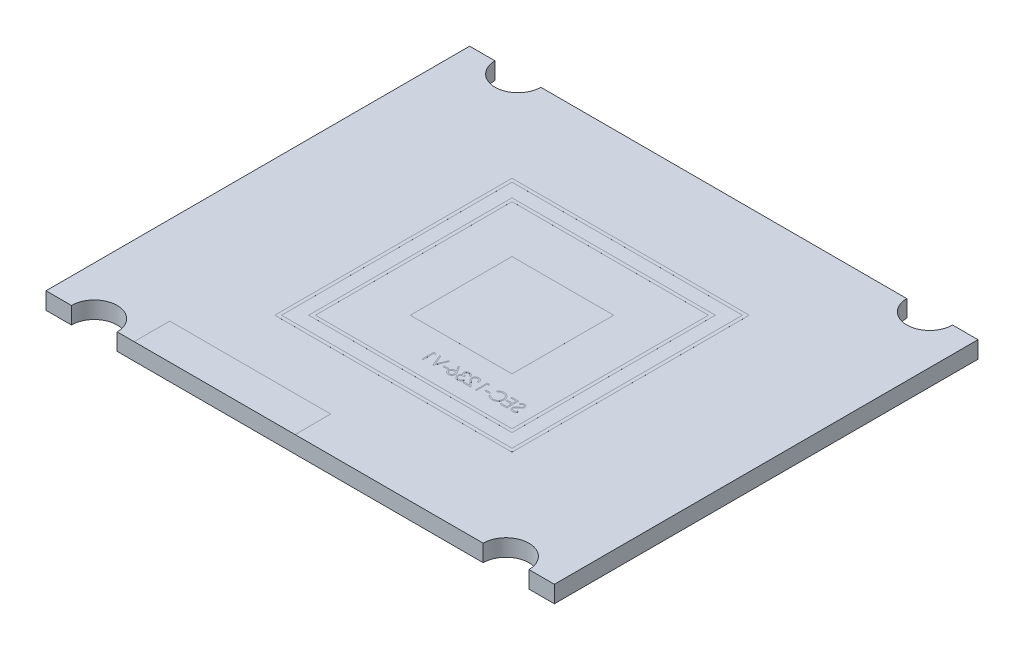
from build123d import *

# Parameters (mm, degrees)
SKETCH1_W               = 30
SKETCH1_H               = 25
BOSS_EXTRUDE1_DEPTH     = 0.5
CUT_EXTRUDE2_DEPTH      = 20.532024985
CUT_EXTRUDE2_DEPTH_BACK = 20.532024985
SKETCH3_R               = 1.35
SKETCH2_W               = 6
SKETCH2_H               = 6
BOSS_EXTRUDE2_DEPTH     = 0.50005
SKETCH4_R               = 2.25
BOSS_EXTRUDE3_DEPTH     = 2
SKETCH5_R               = 0.5
CUT_EXTRUDE3_DEPTH      = 0.4
REVOLVE1_ANGLE          = 180
CHAMFER1_SIZE           = 0.2
SKETCH9_W               = 9.5
SKETCH9_H               = 2.1
MARCA_O_FIOS_DEPTH      = 0.50005
SKETCH10_W              = 14
SKETCH10_H              = 14
SKETCH10_W_2            = 13.6
SKETCH10_H_2            = 13.6
SKETCH10_W_3            = 12
SKETCH10_H_3            = 12
SKETCH10_W_4            = 11.6
SKETCH10_H_4            = 11.6
CONTORNO_C_MERA_DEPTH   = 0.5005
SKETCH11_W              = 0.26923077
SKETCH11_H              = 0.071794871
BOSS_EXTRUDE6_DEPTH     = 0.5005


with BuildPart() as part:
    # Sketch1 → Boss-Extrude1 (new, symmetric)
    with BuildSketch(Plane(origin=(0, 0, 0), x_dir=(1, 0, 0), z_dir=(0, 1, 0))):
        Rectangle(SKETCH1_W, SKETCH1_H)
    extrude(amount=BOSS_EXTRUDE1_DEPTH, both=True)

    # Sketch3 → Cut-Extrude2 (cut, two sides: drawn at the far end of the back side and taken through both)
    with BuildSketch(Plane(origin=(0, 0, 0), x_dir=(1, 0, 0), z_dir=(0, 1, 0)).offset(-CUT_EXTRUDE2_DEPTH_BACK)):
        with Locations((-12.15, 12.5)):
            Circle(SKETCH3_R)
        with Locations((12.15, 12.5)):
            Circle(SKETCH3_R)
        with Locations((12.15, -12.5)):
            Circle(SKETCH3_R)
        with Locations((-12.15, -12.5)):
            Circle(SKETCH3_R)
    extrude(amount=CUT_EXTRUDE2_DEPTH + CUT_EXTRUDE2_DEPTH_BACK, mode=Mode.SUBTRACT)

    # Sketch2 → Boss-Extrude2 (add, symmetric)
    with BuildSketch(Plane(origin=(0, 0, 0), x_dir=(1, 0, 0), z_dir=(0, 1, 0))):
        Rectangle(SKETCH2_W, SKETCH2_H)
    extrude(amount=BOSS_EXTRUDE2_DEPTH, both=True)

    # Sketch4 → Boss-Extrude3 (add)
    with BuildSketch(Plane.XZ.offset(0.50005)):
        with Locations(Location((0, 0, 0), (0, 0, 270))):
            Circle(SKETCH4_R)
    extrude(amount=BOSS_EXTRUDE3_DEPTH)

    # Sketch5 → Cut-Extrude3 (cut)
    with BuildSketch(Plane.XZ.offset(2.50005)):
        with Locations(Location((0, 0, 0), (0, 0, 270))):
            Circle(SKETCH5_R)
    extrude(amount=-CUT_EXTRUDE3_DEPTH, mode=Mode.SUBTRACT)

    # Sketch6 → Revolve1 (revolve)
    with BuildSketch(Plane.XZ.offset(2.10005)):
        with BuildLine():
            Line((-0.5, 0), (0.5, 0))
            ThreePointArc((0.5, 0), (0, 0.5), (-0.5, 0))
        make_face()
    revolve(axis=Axis((-0.5, -2.10005, 0), (1, 0, 0)), revolution_arc=REVOLVE1_ANGLE)

    # Chamfer1
    chamfer1_edges = [part.edges().sort_by_distance(p)[0] for p in [
        (0, -0.50005, 2.25),
        (0, -2.50005, 2.25),
        (0, -2.50005, 0.5),
    ]]
    chamfer(chamfer1_edges, length=CHAMFER1_SIZE)

    # Sketch9 → Marcação Fios (add, symmetric)
    with BuildSketch(Plane(origin=(0, 0, 0), x_dir=(1, 0, 0), z_dir=(0, 1, 0))):
        with Locations((-5.05, -11.45)):
            Rectangle(SKETCH9_W, SKETCH9_H)
    extrude(amount=MARCA_O_FIOS_DEPTH, both=True)

    # Sketch10 → Contorno Câmera (add, symmetric)
    # profile 1 of 2: a face of its own
    with BuildSketch(Plane(origin=(0, 0, 0), x_dir=(1, 0, 0), z_dir=(0, 1, 0))):
        Rectangle(SKETCH10_W, SKETCH10_H)
        Rectangle(SKETCH10_W_2, SKETCH10_H_2, mode=Mode.SUBTRACT)
    # profile 2 of 2: a face of its own
    with BuildSketch(Plane(origin=(0, 0, 0), x_dir=(1, 0, 0), z_dir=(0, 1, 0))):
        Rectangle(SKETCH10_W_3, SKETCH10_H_3)
        Rectangle(SKETCH10_W_4, SKETCH10_H_4, mode=Mode.SUBTRACT)
    extrude(amount=CONTORNO_C_MERA_DEPTH, both=True)

    # Sketch11 → Boss-Extrude6 (add, symmetric)
    # profile 1 of 11: a face of its own
    with BuildSketch(Plane(origin=(0, 0, 0), x_dir=(1, 0, 0), z_dir=(0, 1, 0))):
        with BuildLine():
            Line((5.140170855, -4.761384611), (5.080996176, -4.725907848))
            add(Edge.make_bspline(
                [(5.080996176, -4.725907848), (5.075492528, -4.735120725), (5.064947752, -4.752772242), (5.04735748, -4.77662385), (5.029130898, -4.796896281), (5.010133032, -4.813471603), (4.990479842, -4.82652138), (4.970043031, -4.835761827), (4.948891469, -4.841525022), (4.934496705, -4.842225039), (4.927310278, -4.842574515)],
                knots=[0, 0, 0, 0, 1.272034388, 2.437168799, 3.508375237, 4.49857839, 5.41946034, 6.295179144, 7.148887113, 8, 8, 8, 8], degree=3))
            add(Edge.make_bspline(
                [(4.927310278, -4.842574515), (4.921172906, -4.84240358), (4.909005552, -4.842064702), (4.891093103, -4.838808542), (4.873696743, -4.833806116), (4.857175015, -4.82664193), (4.841755892, -4.817974233), (4.828234553, -4.807504997), (4.816545331, -4.795783756), (4.806983508, -4.782707225), (4.799647501, -4.768643795), (4.794009087, -4.754208605), (4.790880072, -4.739174891), (4.790408721, -4.729052799), (4.790170855, -4.723944707)],
                knots=[0, 0, 0, 0, 1.095163259, 2.171163733, 3.241058638, 4.321873601, 5.38011039, 6.391990106, 7.366004449, 8.327778327, 9.272591725, 10.192022065, 11.087607919, 12, 12, 12, 12], degree=3))
            add(Edge.make_bspline(
                [(4.790170855, -4.723944707), (4.790465718, -4.718116537), (4.791065129, -4.706268719), (4.796131425, -4.688788789), (4.804101275, -4.671490275), (4.811453803, -4.660790022), (4.815271016, -4.655234771)],
                knots=[0, 0, 0, 0, 0.938893495, 1.908633276, 2.914225137, 4, 4, 4, 4], degree=3))
            add(Edge.make_bspline(
                [(4.815271016, -4.655234771), (4.818405138, -4.651225407), (4.824984837, -4.642808247), (4.83629634, -4.6302792), (4.849569563, -4.617355516), (4.864350274, -4.603543705), (4.881176891, -4.589486145), (4.899522394, -4.57451249), (4.919855166, -4.559192174), (4.934115065, -4.548917661), (4.941472939, -4.543616182)],
                knots=[0, 0, 0, 0, 0.722233717, 1.516239348, 2.393582979, 3.351407094, 4.387010283, 5.505090956, 6.712668013, 8, 8, 8, 8], degree=3))
            add(Edge.make_bspline(
                [(4.941472939, -4.543616182), (4.948837738, -4.538370464), (4.962918673, -4.528341052), (4.98261039, -4.513456195), (5.000219282, -4.499847421), (5.015667086, -4.487386618), (5.028947005, -4.476072097), (5.040163687, -4.46601251), (5.049031399, -4.456935797), (5.053962515, -4.451047529), (5.056176464, -4.448403842)],
                knots=[0, 0, 0, 0, 1.452282411, 2.77665338, 3.964542531, 5.026858415, 5.96415736, 6.766646006, 7.446254459, 8, 8, 8, 8], degree=3))
            add(Edge.make_bspline(
                [(5.056176464, -4.448403842), (5.059270973, -4.444283634), (5.065356741, -4.436180694), (5.073389942, -4.423515722), (5.080217774, -4.410551069), (5.085570241, -4.397251896), (5.090077485, -4.38380491), (5.093109071, -4.370034661), (5.09500735, -4.356002938), (5.095201747, -4.346560237), (5.095299061, -4.341833329)],
                knots=[0, 0, 0, 0, 1.068054152, 2.10047183, 3.106115577, 4.101338837, 5.06977816, 6.043150881, 7.020423561, 8, 8, 8, 8], degree=3))
            add(Edge.make_bspline(
                [(5.095299061, -4.341833329), (5.095038019, -4.334427374), (5.094521515, -4.319773761), (5.090153411, -4.298367595), (5.083258833, -4.277930312), (5.073599855, -4.258664245), (5.061148384, -4.241071049), (5.046739189, -4.224948351), (5.029576892, -4.211394635), (5.010746368, -4.199552223), (4.990135093, -4.190283038), (4.968536912, -4.183290842), (4.945917498, -4.179328991), (4.930596871, -4.178760438), (4.922823099, -4.178471951)],
                knots=[0, 0, 0, 0, 1.005424448, 1.989358655, 2.955360095, 3.929531133, 4.905563448, 5.876582895, 6.856512386, 7.866279853, 8.892233794, 9.918561126, 10.94386622, 12, 12, 12, 12], degree=3))
            add(Edge.make_bspline(
                [(4.922823099, -4.178471951), (4.914574279, -4.178756461), (4.898170009, -4.179322261), (4.874040165, -4.184241768), (4.850808022, -4.192381902), (4.832119369, -4.201619634), (4.817492817, -4.210845917), (4.80633827, -4.219249882), (4.79503478, -4.228924903), (4.783491169, -4.239896752), (4.771903037, -4.252266103), (4.760098347, -4.26594824), (4.748049493, -4.280859552), (4.740298321, -4.291504452), (4.736324702, -4.296961534)],
                knots=[0, 0, 0, 0, 1.286793592, 2.559021753, 3.825965368, 5.121522368, 5.803751409, 6.523245864, 7.299691795, 8.125521123, 9.008227632, 9.944561021, 10.946284179, 12, 12, 12, 12], degree=3))
            Line((4.736324702, -4.296961534), (4.793115567, -4.340010412))
            add(Edge.make_bspline(
                [(4.793115567, -4.340010412), (4.796544753, -4.335592674), (4.803148565, -4.327085144), (4.813174462, -4.31517088), (4.822624192, -4.304287585), (4.831934272, -4.294834559), (4.840612998, -4.286294132), (4.849036406, -4.278982181), (4.857083277, -4.272827062), (4.867226659, -4.26625835), (4.879970203, -4.259747049), (4.89596711, -4.254237233), (4.912684365, -4.250926221), (4.924070291, -4.250488444), (4.929834317, -4.250266823)],
                knots=[0, 0, 0, 0, 1.181633172, 2.275549214, 3.290209073, 4.226197932, 5.078386478, 5.862611352, 6.581680152, 7.217281963, 8.414376989, 9.595101626, 10.782541182, 12, 12, 12, 12], degree=3))
            add(Edge.make_bspline(
                [(4.929834317, -4.250266823), (4.937065621, -4.250509163), (4.951010511, -4.250976492), (4.970808558, -4.256080489), (4.988627343, -4.264116862), (5.003937856, -4.275379857), (5.016685252, -4.288724056), (5.025906343, -4.304079827), (5.031456376, -4.321036307), (5.032133632, -4.332864638), (5.032478548, -4.338888617)],
                knots=[0, 0, 0, 0, 1.14458467, 2.207223713, 3.21896685, 4.227309161, 5.202851033, 6.127160689, 7.046193047, 8, 8, 8, 8], degree=3))
            add(Edge.make_bspline(
                [(5.032478548, -4.338888617), (5.032399922, -4.342638913), (5.032242543, -4.350145637), (5.030047584, -4.361235921), (5.027227718, -4.372298189), (5.022759191, -4.383282706), (5.016590131, -4.394381578), (5.008489096, -4.405785925), (4.998286433, -4.417596267), (4.990471031, -4.425277742), (4.986344734, -4.429333329)],
                knots=[0, 0, 0, 0, 0.858281714, 1.717966888, 2.583508476, 3.4729293, 4.427298488, 5.488583878, 6.674047936, 8, 8, 8, 8], degree=3))
            add(Edge.make_bspline(
                [(4.986344734, -4.429333329), (4.984812459, -4.430700734), (4.981172126, -4.433949376), (4.974516941, -4.439267832), (4.965728381, -4.445828386), (4.955035941, -4.45394585), (4.942242468, -4.463362142), (4.927346557, -4.473956865), (4.910514251, -4.486073956), (4.898569867, -4.494545464), (4.892254189, -4.499024835)],
                knots=[0, 0, 0, 0, 0.420754252, 0.999615792, 1.744751191, 2.668019286, 3.750313428, 4.999500688, 6.413464383, 8, 8, 8, 8], degree=3))
            add(Edge.make_bspline(
                [(4.892254189, -4.499024835), (4.884657006, -4.504553107), (4.869946115, -4.51525784), (4.849014599, -4.531340976), (4.830035837, -4.547070529), (4.812943196, -4.562346051), (4.797567815, -4.577051669), (4.784080271, -4.591364305), (4.772343135, -4.60518142), (4.759707291, -4.622895935), (4.746795727, -4.644652152), (4.735707425, -4.6713078), (4.728715756, -4.698067064), (4.727801453, -4.716052431), (4.727350343, -4.724926278)],
                knots=[0, 0, 0, 0, 1.163667725, 2.253281268, 3.268753668, 4.215851969, 5.092017293, 5.902905408, 6.650798638, 7.335211899, 8.59617414, 9.77448103, 10.901945474, 12, 12, 12, 12], degree=3))
            add(Edge.make_bspline(
                [(4.727350343, -4.724926278), (4.72748177, -4.731201951), (4.727742073, -4.743631427), (4.730734256, -4.761882443), (4.735118189, -4.779608617), (4.741725636, -4.796590839), (4.749790267, -4.813139792), (4.760023517, -4.828821372), (4.771885054, -4.843982652), (4.785491807, -4.85821935), (4.800380987, -4.871288589), (4.816117726, -4.882914401), (4.832727781, -4.892608066), (4.850121044, -4.900518234), (4.868301512, -4.906704938), (4.887263068, -4.911187512), (4.907036971, -4.913938654), (4.920477067, -4.914224206), (4.927310278, -4.914369387)],
                knots=[0, 0, 0, 0, 0.983748083, 1.948392443, 2.894712957, 3.844097841, 4.80183111, 5.778335162, 6.776009319, 7.81870978, 8.863265674, 9.881300176, 10.883814829, 11.87499822, 12.874611388, 13.892143829, 14.928324115, 16, 16, 16, 16], degree=3))
            add(Edge.make_bspline(
                [(4.927310278, -4.914369387), (4.932597347, -4.91426715), (4.943104899, -4.914063965), (4.958646795, -4.912267709), (4.973874713, -4.909726288), (4.98859757, -4.905691474), (5.003005052, -4.900796079), (5.017034499, -4.894768413), (5.03069271, -4.887544972), (5.044056226, -4.879285967), (5.057091061, -4.869674418), (5.069674955, -4.858479719), (5.082220792, -4.846010618), (5.094358271, -4.831928505), (5.1063329, -4.816460889), (5.117908582, -4.799463052), (5.129324925, -4.781027581), (5.136488019, -4.768054564), (5.140170855, -4.761384611)],
                knots=[0, 0, 0, 0, 0.915332311, 1.819136955, 2.706846663, 3.586547465, 4.459518054, 5.340707479, 6.227863349, 7.133153174, 8.059268498, 9.028702269, 10.047606654, 11.120612155, 12.245963614, 13.433783089, 14.680604001, 16, 16, 16, 16], degree=3))
        make_face()
    # profile 2 of 11: a face of its own
    with BuildSketch(Plane(origin=(0, 0, 0), x_dir=(1, 0, 0), z_dir=(0, 1, 0))):
        Polygon((4.583760599, -4.196420669), (4.188888804, -4.196420669), (4.188888804, -4.268215541), (4.520940086, -4.268215541), (4.520940086, -4.483600156), (4.188888804, -4.483600156), (4.188888804, -4.555395028), (4.520940086, -4.555395028), (4.520940086, -4.824625797), (4.188888804, -4.824625797), (4.188888804, -4.896420669), (4.583760599, -4.896420669), align=None)
    # profile 3 of 11: a face of its own
    with BuildSketch(Plane(origin=(0, 0, 0), x_dir=(1, 0, 0), z_dir=(0, 1, 0))):
        with BuildLine():
            Line((3.417093932, -4.324866182), (3.472061881, -4.366933489))
            add(Edge.make_bspline(
                [(3.472061881, -4.366933489), (3.475983059, -4.362260295), (3.483772548, -4.352976912), (3.496304389, -4.339941003), (3.509364717, -4.327727951), (3.522948541, -4.316279575), (3.537300365, -4.305996222), (3.552072525, -4.296342001), (3.567512134, -4.287688454), (3.588862481, -4.277195856), (3.616792051, -4.266246625), (3.651951018, -4.257065979), (3.688653238, -4.251221744), (3.713692758, -4.250588776), (3.726428868, -4.250266823)],
                knots=[0, 0, 0, 0, 0.757959112, 1.505699292, 2.245454638, 2.979532153, 3.711538275, 4.438200793, 5.171680507, 5.909471876, 7.393775596, 8.890124382, 10.418191784, 12, 12, 12, 12], degree=3))
            add(Edge.make_bspline(
                [(3.726428868, -4.250266823), (3.733445528, -4.250347615), (3.747413727, -4.25050845), (3.768143421, -4.252630275), (3.788486032, -4.255612517), (3.808428325, -4.260037582), (3.827944916, -4.265632106), (3.847163397, -4.272317189), (3.865805517, -4.280588156), (3.884129164, -4.289729808), (3.901685007, -4.300055297), (3.918296016, -4.311317968), (3.93390161, -4.323391787), (3.948514132, -4.336322008), (3.962148522, -4.3500504), (3.974705984, -4.364723269), (3.986143066, -4.380293703), (3.996686471, -4.396556385), (4.006129018, -4.413463943), (4.014034994, -4.431078957), (4.021036018, -4.449099778), (4.026575867, -4.46773001), (4.03096077, -4.486838563), (4.033986303, -4.506476721), (4.036083997, -4.526603457), (4.036244032, -4.540245319), (4.036324702, -4.547121791)],
                knots=[0, 0, 0, 0, 1.054917814, 2.100044995, 3.131103042, 4.146048494, 5.169673617, 6.183595914, 7.203665975, 8.234915748, 9.262203917, 10.264457458, 11.251630812, 12.227803204, 13.197192746, 14.159520551, 15.12972552, 16.100847026, 17.073214652, 18.039054194, 19.002613845, 19.979014051, 20.95965708, 21.949030935, 22.966165397, 24, 24, 24, 24], degree=3))
            add(Edge.make_bspline(
                [(4.036324702, -4.547121791), (4.036072338, -4.557468054), (4.035576855, -4.577781571), (4.031167188, -4.607535694), (4.02446617, -4.636039828), (4.014423054, -4.663115797), (4.002039244, -4.689097468), (3.986391122, -4.713545239), (3.968267815, -4.736828552), (3.947412931, -4.758397142), (3.924531767, -4.778099887), (3.899982185, -4.795450003), (3.873825328, -4.809912979), (3.846350002, -4.821948169), (3.817344779, -4.831199514), (3.786861818, -4.837712339), (3.754967419, -4.841960775), (3.733173539, -4.842367513), (3.722081913, -4.842574515)],
                knots=[0, 0, 0, 0, 1.029171465, 2.020641659, 2.987623507, 3.938342917, 4.889210282, 5.84687017, 6.821220943, 7.821438502, 8.827599549, 9.822697543, 10.807740252, 11.797342354, 12.80366471, 13.83203677, 14.896651826, 16, 16, 16, 16], degree=3))
            add(Edge.make_bspline(
                [(3.722081913, -4.842574515), (3.709861375, -4.842236759), (3.685808433, -4.841571974), (3.650534828, -4.835940125), (3.616767675, -4.826808541), (3.584505158, -4.814028957), (3.553838229, -4.797415899), (3.524718896, -4.777276323), (3.497122582, -4.753418657), (3.480528326, -4.735202031), (3.472061881, -4.725907848)],
                knots=[0, 0, 0, 0, 1.028121516, 2.023589091, 2.998037872, 3.967518031, 4.937445131, 5.927275754, 6.942489185, 8, 8, 8, 8], degree=3))
            Line((3.472061881, -4.725907848), (3.417093932, -4.767554483))
            add(Edge.make_bspline(
                [(3.417093932, -4.767554483), (3.421517554, -4.773262173), (3.430343609, -4.784650214), (3.444635213, -4.800704556), (3.459690672, -4.815805363), (3.475621814, -4.829830888), (3.492245373, -4.843061781), (3.509859835, -4.855122147), (3.528233641, -4.866180324), (3.547304537, -4.876305709), (3.56705226, -4.885289158), (3.587453147, -4.892979912), (3.608419262, -4.89960489), (3.629951564, -4.905055277), (3.652094715, -4.909309494), (3.67476881, -4.912153429), (3.698022785, -4.914101812), (3.713711069, -4.914279395), (3.72166124, -4.914369387)],
                knots=[0, 0, 0, 0, 0.986787822, 1.968848986, 2.935600012, 3.899624008, 4.868462664, 5.837806735, 6.815139263, 7.798259679, 8.787526145, 9.778297419, 10.776456485, 11.791383307, 12.812564526, 13.85620153, 14.913611965, 16, 16, 16, 16], degree=3))
            add(Edge.make_bspline(
                [(3.72166124, -4.914369387), (3.729189973, -4.914316988), (3.744077111, -4.914213377), (3.766056862, -4.912534943), (3.787454778, -4.910244996), (3.808209703, -4.906796969), (3.828434898, -4.902728101), (3.847947015, -4.89727385), (3.866938057, -4.891164017), (3.885331725, -4.883983019), (3.903143665, -4.875879783), (3.920316427, -4.866721471), (3.936842114, -4.856585098), (3.952883198, -4.845694096), (3.968202715, -4.833698636), (3.98293342, -4.820765309), (3.997157915, -4.806937707), (4.005958452, -4.796966736), (4.010383195, -4.791953521)],
                knots=[0, 0, 0, 0, 1.114604814, 2.203992996, 3.262667896, 4.300477797, 5.318619304, 6.316056647, 7.298880507, 8.271930387, 9.238335007, 10.195173496, 11.151986948, 12.108099108, 13.064862484, 14.031167946, 15.010108607, 16, 16, 16, 16], degree=3))
            add(Edge.make_bspline(
                [(4.010383195, -4.791953521), (4.017470324, -4.783245283), (4.031559019, -4.765933941), (4.049584156, -4.737876745), (4.065013667, -4.708583103), (4.077488851, -4.677899118), (4.087241398, -4.64589364), (4.093997637, -4.612550537), (4.098387958, -4.577900949), (4.098890015, -4.554333591), (4.099145214, -4.542354162)],
                knots=[0, 0, 0, 0, 0.994628077, 1.977248131, 2.950237994, 3.925870899, 4.908910175, 5.911660606, 6.938484602, 8, 8, 8, 8], degree=3))
            add(Edge.make_bspline(
                [(4.099145214, -4.542354162), (4.098834176, -4.529763072), (4.098222226, -4.504990887), (4.093023067, -4.468636096), (4.084659308, -4.433805816), (4.07277993, -4.400565067), (4.05771886, -4.368739011), (4.039113537, -4.33857077), (4.017180109, -4.30986741), (3.992090595, -4.28306446), (3.964577128, -4.25855659), (3.935113365, -4.236995349), (3.903756976, -4.219051846), (3.870853406, -4.204052613), (3.836156269, -4.192523721), (3.799739596, -4.184453083), (3.761671813, -4.17942966), (3.735699328, -4.178794618), (3.722502586, -4.178471951)],
                knots=[0, 0, 0, 0, 1.032925535, 2.032216505, 3.007276963, 3.968222605, 4.92396291, 5.891752235, 6.871517503, 7.883894988, 8.900124299, 9.891468569, 10.874487609, 11.85992873, 12.854644235, 13.869047385, 14.917252991, 16, 16, 16, 16], degree=3))
            add(Edge.make_bspline(
                [(3.722502586, -4.178471951), (3.714459692, -4.178568378), (3.698539592, -4.178759247), (3.674989062, -4.180620476), (3.652060596, -4.183723197), (3.6297384, -4.187946411), (3.607913877, -4.193187875), (3.586753829, -4.200015935), (3.566134091, -4.207823241), (3.54618471, -4.216814934), (3.5270014, -4.226908283), (3.508590136, -4.237991407), (3.491097164, -4.250050568), (3.474399394, -4.262983203), (3.458776152, -4.277062915), (3.443783857, -4.291902434), (3.429931641, -4.307929199), (3.421381002, -4.319210186), (3.417093932, -4.324866182)],
                knots=[0, 0, 0, 0, 1.096760587, 2.17092713, 3.219439832, 4.250915756, 5.268269357, 6.278326846, 7.281116186, 8.274029601, 9.260640565, 10.235837813, 11.203064059, 12.156899882, 13.114053108, 14.069676657, 15.032185724, 16, 16, 16, 16], degree=3))
        make_face()
    # profile 4 of 11: a face of its own
    with BuildSketch(Plane(origin=(0, 0, 0), x_dir=(1, 0, 0), z_dir=(0, 1, 0))):
        with Locations((3.201709317, -4.6271899)):
            Rectangle(SKETCH11_W, SKETCH11_H)
    # profile 5 of 11: a face of its own
    with BuildSketch(Plane(origin=(0, 0, 0), x_dir=(1, 0, 0), z_dir=(0, 1, 0))):
        Polygon((2.864469734, -4.196420669), (2.73504265, -4.196420669), (2.73504265, -4.896420669), (2.797863163, -4.896420669), (2.797863163, -4.268215541), (2.905555471, -4.268215541), align=None)
    # profile 6 of 11: a face of its own
    with BuildSketch(Plane(origin=(0, 0, 0), x_dir=(1, 0, 0), z_dir=(0, 1, 0))):
        with BuildLine():
            Line((2.38504265, -4.411805284), (2.447863163, -4.411805284))
            add(Edge.make_bspline(
                [(2.447863163, -4.411805284), (2.447453732, -4.403471107), (2.446649622, -4.387103004), (2.442883964, -4.363238222), (2.437495788, -4.340427263), (2.429877498, -4.31885328), (2.420416242, -4.298325518), (2.409070237, -4.278925515), (2.395631466, -4.260727277), (2.38039012, -4.243899509), (2.363836392, -4.228461995), (2.345975204, -4.215130946), (2.327206198, -4.203867412), (2.307586319, -4.194451163), (2.286894206, -4.187383194), (2.265317634, -4.182138866), (2.242761807, -4.178983597), (2.227393803, -4.17864444), (2.219577907, -4.178471951)],
                knots=[0, 0, 0, 0, 1.10065271, 2.161652631, 3.183658789, 4.190468796, 5.17591951, 6.163126047, 7.15150782, 8.156236427, 9.156009102, 10.134482811, 11.092018607, 12.041330605, 13.001268258, 13.972401359, 14.968799086, 16, 16, 16, 16], degree=3))
            add(Edge.make_bspline(
                [(2.219577907, -4.178471951), (2.211902292, -4.178651642), (2.196819983, -4.179004729), (2.17480758, -4.182036935), (2.153852121, -4.186786053), (2.133994568, -4.193449136), (2.115393355, -4.202406022), (2.097908746, -4.21316553), (2.081332584, -4.225609496), (2.066411227, -4.240260259), (2.052709611, -4.255900736), (2.04088916, -4.272598316), (2.030766528, -4.289844173), (2.022328992, -4.307769814), (2.016117764, -4.326544019), (2.011402122, -4.34589346), (2.008736639, -4.366018422), (2.008327555, -4.379639733), (2.008119573, -4.386564899)],
                knots=[0, 0, 0, 0, 1.111607364, 2.184268762, 3.212621178, 4.221274766, 5.211760367, 6.196651075, 7.1921475, 8.207485113, 9.220403448, 10.201281604, 11.166441695, 12.114753415, 13.065576456, 14.026450734, 14.996634279, 16, 16, 16, 16], degree=3))
            add(Edge.make_bspline(
                [(2.008119573, -4.386564899), (2.008458226, -4.396314466), (2.009129588, -4.415642509), (2.014872463, -4.444045482), (2.023841766, -4.471564165), (2.034641237, -4.493711626), (2.045535726, -4.511558325), (2.055353227, -4.526252066), (2.06684619, -4.542073159), (2.080181889, -4.558968627), (2.095084464, -4.577070808), (2.111688896, -4.596368767), (2.130113593, -4.616663121), (2.143045293, -4.630524241), (2.149746176, -4.637706726)],
                knots=[0, 0, 0, 0, 1.184426356, 2.348067706, 3.509069118, 4.696110526, 5.333549288, 6.050745305, 6.844228056, 7.710549037, 8.667450064, 9.695053472, 10.805634456, 12, 12, 12, 12], degree=3))
            Line((2.149746176, -4.637706726), (2.3248864, -4.824625797))
            Line((2.3248864, -4.824625797), (1.999145214, -4.824625797))
            Line((1.999145214, -4.824625797), (1.999145214, -4.896420669))
            Line((1.999145214, -4.896420669), (2.47478624, -4.896420669))
            Line((2.47478624, -4.896420669), (2.203311881, -4.606717143))
            add(Edge.make_bspline(
                [(2.203311881, -4.606717143), (2.196702304, -4.599817482), (2.184006658, -4.586564644), (2.166050143, -4.567216052), (2.149922345, -4.549266144), (2.135518867, -4.532748835), (2.123152166, -4.517422521), (2.112177719, -4.50378358), (2.103384601, -4.49123269), (2.093841522, -4.476684567), (2.084598726, -4.458922104), (2.076656254, -4.437215366), (2.071813285, -4.414869916), (2.071232318, -4.399769508), (2.070940086, -4.392173874)],
                knots=[0, 0, 0, 0, 1.329631726, 2.553950428, 3.673215718, 4.687767853, 5.603093632, 6.413772471, 7.123043292, 7.734684054, 8.834405432, 9.900288307, 10.943827018, 12, 12, 12, 12], degree=3))
            add(Edge.make_bspline(
                [(2.070940086, -4.392173874), (2.071067235, -4.387397594), (2.07131782, -4.377984464), (2.073529359, -4.364183312), (2.076871461, -4.35087035), (2.081660512, -4.338004626), (2.08798186, -4.325715495), (2.095676536, -4.313987999), (2.104554549, -4.302650206), (2.114824803, -4.292019547), (2.126107107, -4.282283305), (2.138025957, -4.273658488), (2.150635977, -4.266450666), (2.163884002, -4.260541967), (2.177733096, -4.255906891), (2.192210045, -4.252695175), (2.207274848, -4.250678678), (2.217561547, -4.250405844), (2.222803067, -4.250266823)],
                knots=[0, 0, 0, 0, 0.991446411, 1.95395049, 2.89581595, 3.838931463, 4.798493298, 5.75982156, 6.748411868, 7.785213223, 8.824556874, 9.840280684, 10.836137867, 11.835679398, 12.848801643, 13.863922112, 14.911575587, 16, 16, 16, 16], degree=3))
            add(Edge.make_bspline(
                [(2.222803067, -4.250266823), (2.228277233, -4.250409829), (2.239027593, -4.25069067), (2.254811399, -4.252655203), (2.269868555, -4.256044371), (2.284236935, -4.260679706), (2.297940853, -4.266571416), (2.310913661, -4.273909765), (2.323126239, -4.282666463), (2.334601544, -4.292594574), (2.34517434, -4.303648095), (2.354463715, -4.315970087), (2.362580518, -4.32933557), (2.369662364, -4.34370848), (2.375413502, -4.359219236), (2.379808132, -4.375812777), (2.383285502, -4.393417054), (2.384447206, -4.405574071), (2.38504265, -4.411805284)],
                knots=[0, 0, 0, 0, 1.031018746, 2.02475058, 2.990194455, 3.934040569, 4.864654155, 5.795059489, 6.735614925, 7.690564532, 8.649604399, 9.611025574, 10.590972636, 11.591080095, 12.624614302, 13.701020113, 14.821632451, 16, 16, 16, 16], degree=3))
        make_face()
    # profile 7 of 11: a face of its own
    with BuildSketch(Plane(origin=(0, 0, 0), x_dir=(1, 0, 0), z_dir=(0, 1, 0))):
        with BuildLine():
            Line((1.846581112, -4.35795913), (1.909401625, -4.35795913))
            add(Edge.make_bspline(
                [(1.909401625, -4.35795913), (1.907699714, -4.350912633), (1.904372619, -4.337137309), (1.897433105, -4.317455856), (1.889873254, -4.298831152), (1.880795433, -4.281611937), (1.870893682, -4.265452157), (1.859549138, -4.250718332), (1.847285193, -4.237035739), (1.833720203, -4.224893091), (1.819494471, -4.213897545), (1.804407547, -4.204522534), (1.788762968, -4.196457703), (1.772452342, -4.189813657), (1.755427107, -4.184808552), (1.737841183, -4.181177191), (1.719648483, -4.178818968), (1.707298964, -4.178588816), (1.701028227, -4.178471951)],
                knots=[0, 0, 0, 0, 1.162005537, 2.271625781, 3.343758855, 4.383309926, 5.390229558, 6.379919256, 7.361854164, 8.333198761, 9.295911338, 10.242430842, 11.177959212, 12.116337295, 13.062827104, 14.020064771, 14.994644689, 16, 16, 16, 16], degree=3))
            add(Edge.make_bspline(
                [(1.701028227, -4.178471951), (1.691891679, -4.178747797), (1.673817877, -4.179293472), (1.647265267, -4.184276359), (1.621659903, -4.192161386), (1.597282054, -4.203056131), (1.574638367, -4.216493594), (1.55449113, -4.232486541), (1.537113428, -4.250726401), (1.522534552, -4.270872914), (1.511119552, -4.292404016), (1.502702278, -4.314564048), (1.497577942, -4.337300442), (1.49691383, -4.352651898), (1.496581112, -4.360342944)],
                knots=[0, 0, 0, 0, 1.083050992, 2.142477498, 3.193116406, 4.255571735, 5.30263384, 6.308962982, 7.297363603, 8.282367274, 9.249857812, 10.179914175, 11.08814088, 12, 12, 12, 12], degree=3))
            add(Edge.make_bspline(
                [(1.496581112, -4.360342944), (1.49681383, -4.367744303), (1.497269223, -4.382227614), (1.501135965, -4.403371914), (1.507643217, -4.423300234), (1.51665717, -4.442096466), (1.52832548, -4.459641434), (1.542460019, -4.475974612), (1.559160551, -4.491168444), (1.571816339, -4.499872338), (1.578331913, -4.504353361)],
                knots=[0, 0, 0, 0, 1.024540389, 2.004866551, 2.965041327, 3.920577974, 4.882998113, 5.874504559, 6.905732034, 8, 8, 8, 8], degree=3))
            add(Edge.make_bspline(
                [(1.578331913, -4.504353361), (1.570885562, -4.507948995), (1.556132187, -4.515072987), (1.536022081, -4.529044138), (1.517766506, -4.545175408), (1.507585763, -4.557763938), (1.502470535, -4.564088938)],
                knots=[0, 0, 0, 0, 1.015518401, 2.012035669, 3.001164323, 4, 4, 4, 4], degree=3))
            add(Edge.make_bspline(
                [(1.502470535, -4.564088938), (1.499102266, -4.568700488), (1.492420887, -4.577848072), (1.48417378, -4.592555357), (1.476691958, -4.607425655), (1.470861914, -4.622857536), (1.46634714, -4.638672139), (1.463119934, -4.654896618), (1.461115106, -4.671544222), (1.460827995, -4.682806718), (1.460683676, -4.688467944)],
                knots=[0, 0, 0, 0, 1.025084078, 2.033381695, 3.024893161, 4.013698104, 4.991890475, 5.976764909, 6.982997093, 8, 8, 8, 8], degree=3))
            add(Edge.make_bspline(
                [(1.460683676, -4.688467944), (1.461042579, -4.698269889), (1.461758695, -4.717827649), (1.46815951, -4.746722593), (1.478082158, -4.774967694), (1.492173545, -4.801982662), (1.509347047, -4.827258738), (1.529778512, -4.849874), (1.553235793, -4.86931372), (1.579396923, -4.885555766), (1.607740349, -4.898539351), (1.638055467, -4.907550839), (1.669905478, -4.913420039), (1.691746938, -4.914049413), (1.702851144, -4.914369387)],
                knots=[0, 0, 0, 0, 0.955779014, 1.907060117, 2.875433937, 3.871313158, 4.872415639, 5.851225146, 6.836215519, 7.83643374, 8.849228613, 9.86973379, 10.916971861, 12, 12, 12, 12], degree=3))
            add(Edge.make_bspline(
                [(1.702851144, -4.914369387), (1.710335004, -4.914195744), (1.725060745, -4.913854073), (1.746709445, -4.911518353), (1.767373784, -4.907252352), (1.787081704, -4.901511691), (1.805850711, -4.894233342), (1.823623532, -4.885169603), (1.840509511, -4.874507302), (1.856349301, -4.862120585), (1.871141015, -4.848264317), (1.88449156, -4.832692515), (1.896623518, -4.815693034), (1.907212046, -4.797068423), (1.916739437, -4.777059371), (1.924575628, -4.755409672), (1.931472742, -4.732312867), (1.934679434, -4.716217319), (1.936324702, -4.70795913)],
                knots=[0, 0, 0, 0, 1.048658725, 2.063410685, 3.046034179, 4.001477787, 4.936774919, 5.862367409, 6.792675028, 7.730719943, 8.675894397, 9.627829632, 10.600096036, 11.597688215, 12.626045268, 13.701542398, 14.82072376, 16, 16, 16, 16], degree=3))
            Line((1.936324702, -4.70795913), (1.873504189, -4.70795913))
            add(Edge.make_bspline(
                [(1.873504189, -4.70795913), (1.87186753, -4.713348933), (1.868684088, -4.723832567), (1.863265228, -4.738920628), (1.857091574, -4.752752239), (1.850468662, -4.765428863), (1.843512973, -4.777075344), (1.835729988, -4.787383718), (1.827696159, -4.796806758), (1.821640288, -4.802115681), (1.818676464, -4.804713938)],
                knots=[0, 0, 0, 0, 1.198163088, 2.33053128, 3.407730985, 4.417276592, 5.372219308, 6.28897303, 7.162600585, 8, 8, 8, 8], degree=3))
            add(Edge.make_bspline(
                [(1.818676464, -4.804713938), (1.814757149, -4.807735605), (1.806930616, -4.813769611), (1.79417697, -4.821469937), (1.780763993, -4.828142142), (1.766401058, -4.833238881), (1.751398104, -4.837554413), (1.735512631, -4.840378517), (1.718884788, -4.842316151), (1.707531235, -4.842487138), (1.701729349, -4.842574515)],
                knots=[0, 0, 0, 0, 0.946170439, 1.889420265, 2.845303464, 3.807233317, 4.801018734, 5.828864929, 6.890507805, 8, 8, 8, 8], degree=3))
            add(Edge.make_bspline(
                [(1.701729349, -4.842574515), (1.695178648, -4.842451334), (1.682369319, -4.842210464), (1.663678347, -4.839995323), (1.645896858, -4.83676924), (1.629222273, -4.831786643), (1.613436171, -4.825630473), (1.598759841, -4.817900792), (1.58500062, -4.808831848), (1.572334739, -4.798524016), (1.560945637, -4.787239717), (1.550917735, -4.775437103), (1.542392802, -4.763165937), (1.535516087, -4.750358313), (1.530085977, -4.737067267), (1.526389337, -4.723255501), (1.523819034, -4.709036048), (1.523609711, -4.699370254), (1.523504189, -4.694497592)],
                knots=[0, 0, 0, 0, 1.217147791, 2.380027433, 3.494444702, 4.572153297, 5.609568379, 6.639424714, 7.649109417, 8.668170816, 9.669597737, 10.625200337, 11.543417969, 12.441394052, 13.322311151, 14.205496177, 15.095365482, 16, 16, 16, 16], degree=3))
            add(Edge.make_bspline(
                [(1.523504189, -4.694497592), (1.523810249, -4.687975324), (1.524420847, -4.674963242), (1.529082563, -4.655819728), (1.536750335, -4.637375045), (1.547484838, -4.619943887), (1.560551983, -4.603788707), (1.575824965, -4.58937441), (1.59343061, -4.577480392), (1.609634584, -4.569262661), (1.623987616, -4.563655246), (1.636270692, -4.559920253), (1.650022013, -4.556757522), (1.665075283, -4.553815067), (1.681543926, -4.551310798), (1.699410014, -4.549222435), (1.718677166, -4.547551426), (1.732015399, -4.546805207), (1.738888804, -4.546420669)],
                knots=[0, 0, 0, 0, 1.07054697, 2.135767047, 3.216561865, 4.33974944, 5.486079747, 6.621378074, 7.775625952, 8.963672916, 9.598146892, 10.304877434, 11.070270905, 11.915000392, 12.823868403, 13.805723172, 14.86925407, 16, 16, 16, 16], degree=3))
            Line((1.738888804, -4.546420669), (1.738888804, -4.474625797))
            add(Edge.make_bspline(
                [(1.738888804, -4.474625797), (1.730228571, -4.474478836), (1.713265302, -4.474190976), (1.688486441, -4.470709374), (1.664791778, -4.465893248), (1.64270643, -4.45851621), (1.622576687, -4.449948151), (1.605112767, -4.439977709), (1.590559337, -4.428894759), (1.578987123, -4.416528237), (1.570281277, -4.403265228), (1.563915918, -4.389441896), (1.560155853, -4.374937084), (1.559653919, -4.36503815), (1.559401625, -4.360062496)],
                knots=[0, 0, 0, 0, 1.321986639, 2.589447074, 3.816329219, 5.01088745, 6.139805852, 7.153945165, 8.075214402, 8.924034688, 9.728124013, 10.488707548, 11.240355623, 12, 12, 12, 12], degree=3))
            add(Edge.make_bspline(
                [(1.559401625, -4.360062496), (1.559484507, -4.356406947), (1.559649397, -4.349134405), (1.561728853, -4.338509391), (1.564853661, -4.328209202), (1.569149607, -4.31827764), (1.574899646, -4.308783585), (1.581780844, -4.299646096), (1.589974464, -4.29091734), (1.599363553, -4.282781276), (1.609445914, -4.275027428), (1.620495869, -4.268444701), (1.632180244, -4.262815689), (1.644511975, -4.258173788), (1.657531081, -4.254681931), (1.671176393, -4.252174762), (1.685473929, -4.250607231), (1.695228276, -4.250381548), (1.700186881, -4.250266823)],
                knots=[0, 0, 0, 0, 0.884392785, 1.759457502, 2.611959086, 3.489218968, 4.37281399, 5.2945488, 6.255912374, 7.266815255, 8.301784654, 9.332968512, 10.37626691, 11.440494194, 12.520033166, 13.637162961, 14.798855837, 16, 16, 16, 16], degree=3))
            add(Edge.make_bspline(
                [(1.700186881, -4.250266823), (1.708157215, -4.250545095), (1.72372513, -4.251088626), (1.746168113, -4.255849228), (1.76703198, -4.263444845), (1.782979713, -4.272511449), (1.794756228, -4.281461536), (1.803171616, -4.289278013), (1.811435718, -4.297964578), (1.819004853, -4.308056253), (1.826659649, -4.318869611), (1.833628561, -4.330954347), (1.840400499, -4.343995226), (1.844481009, -4.353214353), (1.846581112, -4.35795913)],
                knots=[0, 0, 0, 0, 1.472543308, 2.876219568, 4.221790263, 5.565193594, 6.249813518, 6.953379497, 7.687249741, 8.463570142, 9.283606569, 10.136032583, 11.040678096, 12, 12, 12, 12], degree=3))
        make_face()
    # profile 8 of 11: a face of its own
    with BuildSketch(Plane(origin=(0, 0, 0), x_dir=(1, 0, 0), z_dir=(0, 1, 0))):
        with BuildLine():
            Line((1.07478624, -4.178471951), (1.026408836, -4.216472752))
            Line((1.026408836, -4.216472752), (1.211364766, -4.499305284))
            add(Edge.make_bspline(
                [(1.211364766, -4.499305284), (1.19905071, -4.497342512), (1.175030753, -4.493513903), (1.150717573, -4.492882314), (1.138868772, -4.492574515)],
                knots=[0, 0, 0, 0, 1.025318673, 2, 2, 2, 2], degree=3))
            add(Edge.make_bspline(
                [(1.138868772, -4.492574515), (1.131754273, -4.492765737), (1.117749593, -4.493142153), (1.097188232, -4.496038923), (1.077430445, -4.500603945), (1.058558123, -4.507258396), (1.040503526, -4.515758867), (1.023163047, -4.525946641), (1.006862645, -4.538347777), (0.991392409, -4.552200769), (0.97734699, -4.567544165), (0.964911779, -4.583824433), (0.95446642, -4.601024609), (0.945991636, -4.619135982), (0.93941066, -4.638130634), (0.934613131, -4.657984262), (0.931777213, -4.678710556), (0.931392114, -4.692806191), (0.931196496, -4.699966342)],
                knots=[0, 0, 0, 0, 1.04369286, 2.054478336, 3.041073146, 4.015093852, 4.984733326, 5.965804835, 6.960378782, 7.985147595, 9.009457201, 10.008161701, 10.986880575, 11.956520048, 12.937015923, 13.931873656, 14.949455224, 16, 16, 16, 16], degree=3))
            add(Edge.make_bspline(
                [(0.931196496, -4.699966342), (0.931481117, -4.709762283), (0.932041184, -4.729038376), (0.937621943, -4.757113717), (0.946293872, -4.78386022), (0.958689378, -4.808850854), (0.974085855, -4.832051368), (0.992861373, -4.852608461), (1.014350071, -4.870942469), (1.03864743, -4.886273793), (1.064796023, -4.898794403), (1.092266423, -4.907787451), (1.120791852, -4.913324145), (1.140152774, -4.914018266), (1.149946496, -4.914369387)],
                knots=[0, 0, 0, 0, 1.031375318, 2.029502543, 3.004789286, 3.987476834, 4.960371455, 5.9300674, 6.912260825, 7.929083631, 8.949397511, 9.960523116, 10.96833055, 12, 12, 12, 12], degree=3))
            add(Edge.make_bspline(
                [(1.149946496, -4.914369387), (1.159365837, -4.914063746), (1.1780239, -4.913458324), (1.205470459, -4.908065136), (1.231843062, -4.899323716), (1.256956939, -4.88728086), (1.280221061, -4.872069283), (1.301034189, -4.853756828), (1.319292543, -4.832734935), (1.334487468, -4.809006865), (1.346539214, -4.783508874), (1.355577199, -4.756921442), (1.360856448, -4.729341446), (1.361594159, -4.710645218), (1.361965727, -4.701228361)],
                knots=[0, 0, 0, 0, 1.012016664, 2.004627821, 2.994792927, 3.992885782, 4.990978636, 5.973936114, 6.964471063, 7.975201453, 8.993600317, 9.990122807, 10.98767138, 12, 12, 12, 12], degree=3))
            add(Edge.make_bspline(
                [(1.361965727, -4.701228361), (1.361729438, -4.694019444), (1.361246981, -4.679300214), (1.357878303, -4.657007408), (1.352465344, -4.634197192), (1.346403295, -4.614846353), (1.339998173, -4.598994049), (1.334667665, -4.586213351), (1.328032866, -4.573061136), (1.32095819, -4.559086409), (1.312806816, -4.544649322), (1.303943686, -4.529508589), (1.294123756, -4.513905003), (1.287239723, -4.503316164), (1.283720535, -4.497903041)],
                knots=[0, 0, 0, 0, 1.173818275, 2.396712641, 3.66331629, 4.989737886, 5.693666774, 6.447286557, 7.243889047, 8.091586357, 8.998013824, 9.943181721, 10.948533338, 12, 12, 12, 12], degree=3))
            Line((1.283720535, -4.497903041), (1.07478624, -4.178471951))
        make_face()
        with BuildLine():
            add(Edge.make_bspline(
                [(1.152049862, -4.564369387), (1.157382311, -4.564524995), (1.167798133, -4.564828944), (1.183079616, -4.566593995), (1.197542266, -4.569917808), (1.211377693, -4.574151074), (1.224327233, -4.579971686), (1.236485001, -4.587042046), (1.247898012, -4.595366282), (1.258446722, -4.604826464), (1.268010655, -4.615184071), (1.276246881, -4.626277975), (1.283351361, -4.637840816), (1.289127724, -4.649969204), (1.29362574, -4.662658504), (1.29687939, -4.675850354), (1.29869014, -4.689633215), (1.298991386, -4.698979716), (1.299145214, -4.703752399)],
                knots=[0, 0, 0, 0, 1.129588631, 2.206414736, 3.251139165, 4.268635594, 5.265702196, 6.250456724, 7.242448911, 8.251968645, 9.246821453, 10.222880186, 11.173611482, 12.116736599, 13.062300278, 14.020270554, 14.989073742, 16, 16, 16, 16], degree=3))
            add(Edge.make_bspline(
                [(1.299145214, -4.703752399), (1.299019942, -4.708482395), (1.298774302, -4.717757213), (1.296543838, -4.731425049), (1.293136821, -4.744578031), (1.288068742, -4.757148351), (1.282023364, -4.769327614), (1.2740423, -4.780674671), (1.265198942, -4.791878685), (1.254628156, -4.80207898), (1.243283483, -4.811570305), (1.231163243, -4.819866355), (1.218531251, -4.82696359), (1.205216966, -4.832525809), (1.19140929, -4.837090667), (1.176993179, -4.840302963), (1.161958608, -4.842119068), (1.15177422, -4.842420707), (1.146581112, -4.842574515)],
                knots=[0, 0, 0, 0, 0.989467248, 1.94019797, 2.891935182, 3.827694429, 4.772920941, 5.730924762, 6.725747692, 7.756678648, 8.79901574, 9.819492441, 10.826891316, 11.826466727, 12.835195252, 13.867842842, 14.912794438, 16, 16, 16, 16], degree=3))
            add(Edge.make_bspline(
                [(1.146581112, -4.842574515), (1.141388012, -4.842420695), (1.131203641, -4.842119032), (1.116168949, -4.840303098), (1.101753285, -4.837090169), (1.087943984, -4.832527615), (1.074635697, -4.826956893), (1.062014753, -4.819910509), (1.050009134, -4.811519285), (1.038657015, -4.8020952), (1.028130227, -4.791820629), (1.019074771, -4.780774685), (1.011338124, -4.769235906), (1.005051287, -4.757196328), (1.000039029, -4.74457043), (0.996614735, -4.731427086), (0.994388878, -4.71775668), (0.994142604, -4.708482215), (0.994017009, -4.703752399)],
                knots=[0, 0, 0, 0, 1.087397944, 2.132534446, 3.165364764, 4.174271784, 5.174024072, 6.181601208, 7.194203697, 8.236725232, 9.267838612, 10.269026844, 11.221737037, 12.171628256, 13.107553087, 14.05945871, 15.010357665, 16, 16, 16, 16], degree=3))
            add(Edge.make_bspline(
                [(0.994017009, -4.703752399), (0.994127068, -4.698973489), (0.994343077, -4.689594043), (0.996786267, -4.675856519), (1.000174742, -4.662591478), (1.005291348, -4.649882288), (1.011938657, -4.637779103), (1.020035338, -4.626220782), (1.029401852, -4.615118713), (1.04022136, -4.604806151), (1.051999407, -4.595376736), (1.064522524, -4.587052824), (1.077624119, -4.580027829), (1.091290907, -4.574166409), (1.105679484, -4.569936514), (1.120557551, -4.566605865), (1.1361154, -4.564833462), (1.146670722, -4.564526049), (1.152049862, -4.564369387)],
                knots=[0, 0, 0, 0, 0.978206639, 1.919901502, 2.851605144, 3.780102724, 4.718870031, 5.675451981, 6.667674623, 7.690630536, 8.733308323, 9.756129687, 10.767539656, 11.776269907, 12.797430371, 13.836405707, 14.897401972, 16, 16, 16, 16], degree=3))
        make_face(mode=Mode.SUBTRACT)
    # profile 9 of 11: a face of its own
    with BuildSketch(Plane(origin=(0, 0, 0), x_dir=(1, 0, 0), z_dir=(0, 1, 0))):
        with Locations((0.72478624, -4.6271899)):
            Rectangle(SKETCH11_W, SKETCH11_H)
    # profile 10 of 11: a face of its own
    with BuildSketch(Plane(origin=(0, 0, 0), x_dir=(1, 0, 0), z_dir=(0, 1, 0))):
        Polygon((0.527350343, -4.196420669), (0.46004265, -4.196420669), (0.226709317, -4.748063297), (-0.006624016, -4.196420669), (-0.073931709, -4.196420669), (0.222222137, -4.896420669), (0.231196496, -4.896420669), align=None)
    # profile 11 of 11: a face of its own
    with BuildSketch(Plane(origin=(0, 0, 0), x_dir=(1, 0, 0), z_dir=(0, 1, 0))):
        Polygon((-0.285530266, -4.196420669), (-0.41495735, -4.196420669), (-0.41495735, -4.896420669), (-0.352136837, -4.896420669), (-0.352136837, -4.268215541), (-0.244444529, -4.268215541), align=None)
    extrude(amount=BOSS_EXTRUDE6_DEPTH, both=True)


solid = part.part
